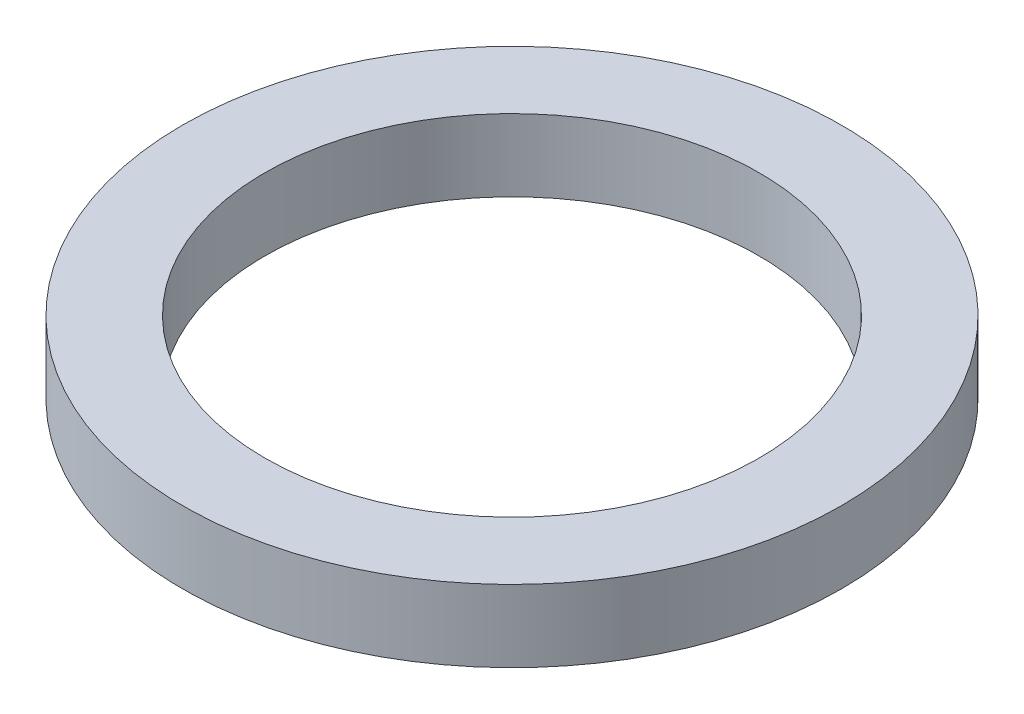
from build123d import *

# Parameters (mm, degrees)
SKETCH1_R           = 8
SKETCH1_R_2         = 6
EXTRUDE_THIN1_DEPTH = 1.75


with BuildPart() as part:
    # Sketch1 → Extrude-Thin1 (new body)
    with BuildSketch(Plane(origin=(0, 0, 0), x_dir=(1, 0, 0), z_dir=(0, 1, 0))):
        Circle(SKETCH1_R)
        Circle(SKETCH1_R_2, mode=Mode.SUBTRACT)
    extrude(amount=EXTRUDE_THIN1_DEPTH)


solid = part.part
